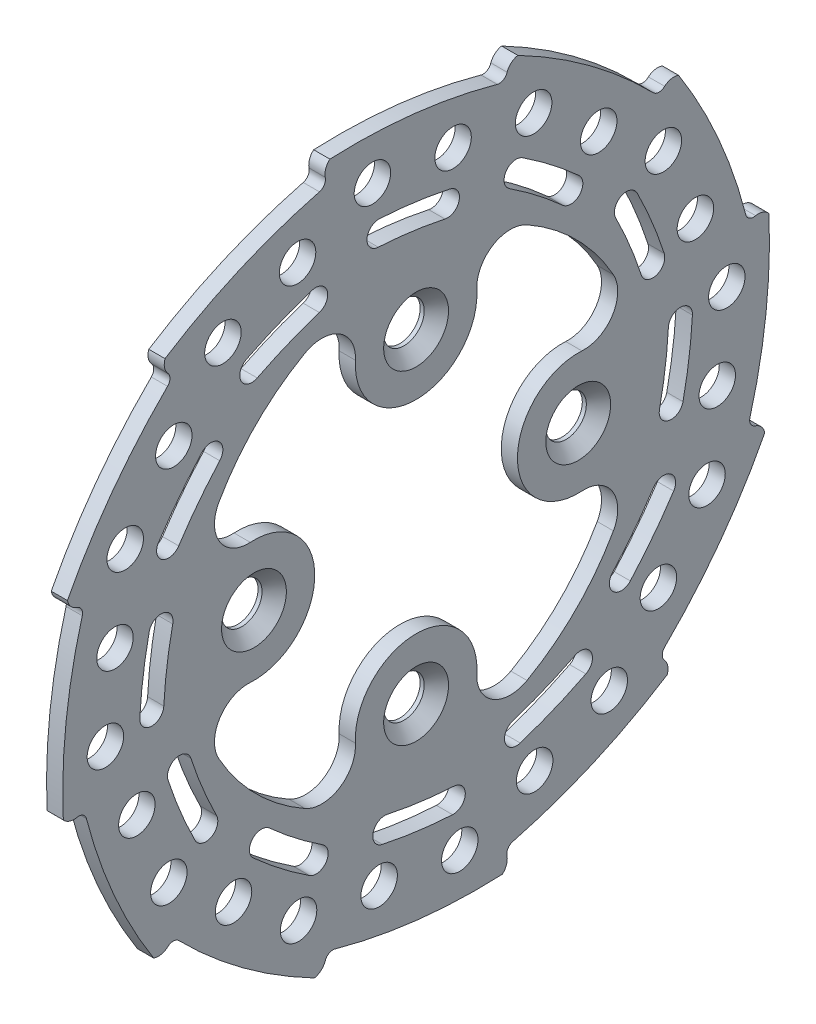
from build123d import *

# Parameters (mm, degrees)
SKETCH1_R           = 4.5
SKETCH1_R_2         = 5
BOSS_EXTRUDE1_DEPTH = 4
CHAMFER1_SIZE       = 3


with BuildPart() as part:
    # Sketch1 → Boss-Extrude1 (new body)
    with BuildSketch(Plane(origin=(4, 0, 0), x_dir=(0, 0, -1), z_dir=(1, 0, 0))):
        with BuildLine():
            ThreePointArc((-86.018670255, 25.093026142), (-85.14663657, 23.368422018), (-83.491153558, 22.37138735))
            Line((-83.491153558, 22.37138735), (-83.749739244, 22.440675176))
            ThreePointArc((-83.749739244, 22.440675176), (-82.550452091, 21.515925209), (-82.363415589, 20.013104685))
            ThreePointArc((-82.363415589, 20.013104685), (-86.341116655, -0.446853787), (-87.040866686, -21.278136905))
            ThreePointArc((-87.040866686, -21.278136905), (-85.423361304, -22.335671048), (-83.491153628, -22.371386896))
            Line((-83.491153628, -22.371386896), (-83.749739307, -22.44067472))
            ThreePointArc((-83.749739307, -22.44067472), (-82.248751182, -22.641888108), (-81.33536256, -23.849850608))
            ThreePointArc((-81.33536256, -23.849850608), (-74.550173469, -43.55754504), (-64.740533156, -61.947840518))
            ThreePointArc((-64.740533156, -61.947840518), (-62.810965331, -62.054939253), (-61.119766475, -61.119766243))
            Line((-61.119766475, -61.119766243), (-61.309064338, -61.309064106))
            ThreePointArc((-61.309064338, -61.309064106), (-59.908563797, -60.732825947), (-58.513564795, -61.322257846))
            ThreePointArc((-58.513564795, -61.322257846), (-42.78357145, -74.997027311), (-25.093025994, -86.018670202))
            ThreePointArc((-25.093025994, -86.018670202), (-23.368421895, -85.146636507), (-22.371387243, -83.491153507))
            Line((-22.371387243, -83.491153507), (-22.440675066, -83.749739182))
            ThreePointArc((-22.440675066, -83.749739182), (-21.515925099, -82.550452028), (-20.013104576, -82.363415525))
            ThreePointArc((-20.013104576, -82.363415525), (0.446853958, -86.341116583), (21.278137137, -87.040866585))
            ThreePointArc((21.278137137, -87.040866585), (22.335671395, -85.423361165), (22.371387267, -83.491153395))
            Line((22.371387267, -83.491153395), (22.440675097, -83.749739097))
            ThreePointArc((22.440675097, -83.749739097), (22.641888482, -82.248750972), (23.849850979, -81.335362346))
            ThreePointArc((23.849850979, -81.335362346), (43.55754532, -74.550173223), (61.947840706, -64.7405329))
            ThreePointArc((61.947840706, -64.7405329), (62.054939409, -62.810965107), (61.119766406, -61.119766286))
            Line((61.119766406, -61.119766286), (61.30906424, -61.309064119))
            ThreePointArc((61.30906424, -61.309064119), (60.732826081, -59.908563581), (61.322257978, -58.513564579))
            ThreePointArc((61.322257978, -58.513564579), (74.997027319, -42.783571336), (86.018670123, -25.093026012))
            ThreePointArc((86.018670123, -25.093026012), (85.146636466, -23.368421786), (83.4911534, -22.371387057))
            Line((83.4911534, -22.371387057), (83.749739198, -22.440674913))
            ThreePointArc((83.749739198, -22.440674913), (82.550452046, -21.515924947), (82.363415542, -20.013104426))
            ThreePointArc((82.363415542, -20.013104426), (86.341116572, 0.446854079), (87.040866557, 21.278137224))
            ThreePointArc((87.040866557, 21.278137224), (85.423361182, 22.335671327), (83.491153534, 22.371387165))
            Line((83.491153534, 22.371387165), (83.749739235, 22.440674994))
            ThreePointArc((83.749739235, 22.440674994), (82.248751112, 22.641888382), (81.335362488, 23.849850879))
            ThreePointArc((81.335362488, 23.849850879), (74.550173373, 43.557545259), (64.740533048, 61.947840683))
            ThreePointArc((64.740533048, 61.947840683), (62.810965153, 62.054939483), (61.119766223, 61.119766455))
            Line((61.119766223, 61.119766455), (61.309064147, 61.309064379))
            ThreePointArc((61.309064147, 61.309064379), (59.908563608, 60.73282622), (58.513564607, 61.322258116))
            ThreePointArc((58.513564607, 61.322258116), (42.783571403, 74.997027414), (25.093026131, 86.018670193))
            ThreePointArc((25.093026131, 86.018670193), (23.368421841, 85.14663655), (22.371387074, 83.491153446))
            Line((22.371387074, 83.491153446), (22.44067494, 83.749739283))
            ThreePointArc((22.44067494, 83.749739283), (21.515924975, 82.550452129), (20.013104453, 82.363415625))
            ThreePointArc((20.013104453, 82.363415625), (-0.446854092, 86.341116662), (-21.278137277, 87.040866642))
            ThreePointArc((-21.278137277, 87.040866642), (-22.335671323, 85.423361278), (-22.371387144, 83.491153671))
            Line((-22.371387144, 83.491153671), (-22.440674969, 83.749739354))
            ThreePointArc((-22.440674969, 83.749739354), (-22.641888355, 82.248751229), (-23.849850854, 81.335362604))
            ThreePointArc((-23.849850854, 81.335362604), (-43.557545227, 74.550173501), (-61.947840649, 64.740533195))
            ThreePointArc((-61.947840649, 64.740533195), (-62.054939394, 62.810965365), (-61.119766383, 61.119766503))
            Line((-61.119766383, 61.119766503), (-61.309064244, 61.309064364))
            ThreePointArc((-61.309064244, 61.309064364), (-60.732826085, 59.908563824), (-61.322257984, 58.513564821))
            ThreePointArc((-61.322257984, 58.513564821), (-74.997027395, 42.78357153), (-86.018670255, 25.093026142))
        make_face()
        with Locations((-45.046348597, -59.778523638)):
            Circle(SKETCH1_R, mode=Mode.SUBTRACT)
        with Locations((-60.999633167, -47.658136616)):
            Circle(SKETCH1_R, mode=Mode.SUBTRACT)
        with Locations((-28.998163636, -71.77297359)):
            Circle(SKETCH1_R, mode=Mode.SUBTRACT)
        with Locations((-9.122020413, -74.29289437)):
            Circle(SKETCH1_R, mode=Mode.SUBTRACT)
        with BuildLine():
            ThreePointArc((-26.291327741, -63.53719733), (-33.430015175, -58.462343647), (-40.153643305, -52.849160686))
            ThreePointArc((-40.153643305, -52.849160686), (-40.367322044, -48.659253445), (-36.177414803, -48.445574706))
            ThreePointArc((-36.177414803, -48.445574706), (-29.807264332, -53.76365884), (-23.043875245, -58.57171499))
            ThreePointArc((-23.043875245, -58.57171499), (-22.184860323, -62.678182407), (-26.291327741, -63.53719733))
        make_face(mode=Mode.SUBTRACT)
        with Locations((-68.900544051, -29.246545773)):
            Circle(SKETCH1_R, mode=Mode.SUBTRACT)
        with BuildLine():
            ThreePointArc((-49.24243886, -39.202655502), (-50.551743823, -43.188468066), (-54.537556387, -41.879163102))
            ThreePointArc((-54.537556387, -41.879163102), (-58.182414213, -33.914867175), (-61.198655499, -25.691894069))
            ThreePointArc((-61.198655499, -25.691894069), (-59.288753095, -21.956488591), (-55.553347617, -23.866390995))
            ThreePointArc((-55.553347617, -23.866390995), (-52.69567755, -31.65706219), (-49.24243886, -39.202655502))
        make_face(mode=Mode.SUBTRACT)
        with Locations((-76.656300252, -10.773340423)):
            Circle(SKETCH1_R, mode=Mode.SUBTRACT)
        with BuildLine():
            ThreePointArc((-68.170490843, -8.999640943), (-67.34488235, -0.279929433), (-65.845537375, 8.349494814))
            ThreePointArc((-65.845537375, 8.349494814), (-62.323810635, 10.62949965), (-60.043805798, 7.10777291))
            ThreePointArc((-60.043805798, 7.10777291), (-61.464326522, -1.067981291), (-62.246530747, -9.329276131))
            ThreePointArc((-62.246530747, -9.329276131), (-65.373328389, -12.126438585), (-68.170490843, -8.999640943))
        make_face(mode=Mode.SUBTRACT)
        with Locations((10.773340423, -76.656300252)):
            Circle(SKETCH1_R, mode=Mode.SUBTRACT)
        with Locations((29.246545773, -68.900544051)):
            Circle(SKETCH1_R, mode=Mode.SUBTRACT)
        with BuildLine():
            ThreePointArc((8.999640943, -68.170490842), (0.279929433, -67.344882349), (-8.349494814, -65.845537374))
            ThreePointArc((-8.349494814, -65.845537374), (-10.629499649, -62.323810635), (-7.10777291, -60.0438058))
            ThreePointArc((-7.10777291, -60.0438058), (1.067981291, -61.464326524), (9.329276131, -62.246530749))
            ThreePointArc((9.329276131, -62.246530749), (12.126438584, -65.37332839), (8.999640943, -68.170490842))
        make_face(mode=Mode.SUBTRACT)
        with BuildLine():
            ThreePointArc((41.879163103, -54.537556387), (33.914867175, -58.182414213), (25.69189407, -61.198655499))
            ThreePointArc((25.69189407, -61.198655499), (21.956488591, -59.288753096), (23.866390995, -55.553347617))
            ThreePointArc((23.866390995, -55.553347617), (31.65706219, -52.69567755), (39.202655503, -49.242438859))
            ThreePointArc((39.202655503, -49.242438859), (43.188468067, -50.551743823), (41.879163103, -54.537556387))
        make_face(mode=Mode.SUBTRACT)
        with Locations((47.658136616, -60.999633167)):
            Circle(SKETCH1_R, mode=Mode.SUBTRACT)
        with Locations((59.778523638, -45.046348596)):
            Circle(SKETCH1_R, mode=Mode.SUBTRACT)
        with BuildLine():
            ThreePointArc((48.674377168, 27.370060379), (48.473017416, 18.865297032), (40.908809804, 14.972443512))
            ThreePointArc((40.908809804, 14.972443511), (25.000000001, -1e-09), (40.908809804, -14.972443513))
            ThreePointArc((40.908809804, -14.972443513), (48.473017416, -18.865297033), (48.674377168, -27.37006038))
            ThreePointArc((48.674377168, -27.37006038), (39.486169717, -39.486169718), (27.37006038, -48.674377168))
            ThreePointArc((27.37006038, -48.674377168), (18.865297033, -48.473017417), (14.972443512, -40.908809805))
            ThreePointArc((14.972443513, -40.908809805), (0, -25), (-14.972443513, -40.908809805))
            ThreePointArc((-14.972443512, -40.908809805), (-18.865297033, -48.473017417), (-27.370060379, -48.674377168))
            ThreePointArc((-27.370060379, -48.674377168), (-39.486169717, -39.486169718), (-48.674377168, -27.37006038))
            ThreePointArc((-48.674377168, -27.37006038), (-48.473017416, -18.865297033), (-40.908809804, -14.972443513))
            ThreePointArc((-40.908809804, -14.972443513), (-24.999999999, 0), (-40.908809804, 14.972443513))
            ThreePointArc((-40.908809804, 14.972443512), (-48.473017416, 18.865297032), (-48.674377168, 27.370060379))
            ThreePointArc((-48.674377168, 27.370060379), (-39.486169717, 39.486169717), (-27.370060379, 48.674377168))
            ThreePointArc((-27.370060379, 48.674377168), (-18.865297033, 48.473017416), (-14.972443512, 40.908809804))
            ThreePointArc((-14.972443512, 40.908809804), (1e-09, 25), (14.972443513, 40.908809804))
            ThreePointArc((14.972443512, 40.908809804), (18.865297033, 48.473017416), (27.37006038, 48.674377168))
            ThreePointArc((27.37006038, 48.674377168), (39.486169717, 39.486169717), (48.674377168, 27.370060379))
        make_face(mode=Mode.SUBTRACT)
        with BuildLine():
            ThreePointArc((63.53719733, -26.291327741), (58.462343647, -33.430015175), (52.849160686, -40.153643305))
            ThreePointArc((52.849160686, -40.153643305), (48.659253445, -40.367322044), (48.445574706, -36.177414803))
            ThreePointArc((48.445574706, -36.177414803), (53.76365884, -29.807264332), (58.57171499, -23.043875245))
            ThreePointArc((58.57171499, -23.043875245), (62.678182408, -22.184860323), (63.53719733, -26.291327741))
        make_face(mode=Mode.SUBTRACT)
        with Locations((71.77297359, -28.998163636)):
            Circle(SKETCH1_R, mode=Mode.SUBTRACT)
        with Locations((74.29289437, -9.122020413)):
            Circle(SKETCH1_R, mode=Mode.SUBTRACT)
        with Locations((-74.29289437, 9.122020413)):
            Circle(SKETCH1_R, mode=Mode.SUBTRACT)
        with Locations((-71.77297359, 28.998163636)):
            Circle(SKETCH1_R, mode=Mode.SUBTRACT)
        with BuildLine():
            ThreePointArc((-63.53719733, 26.29132774), (-58.462343647, 33.430015175), (-52.849160686, 40.153643305))
            ThreePointArc((-52.849160686, 40.153643305), (-48.659253446, 40.367322044), (-48.445574707, 36.177414804))
            ThreePointArc((-48.445574707, 36.177414804), (-53.763658841, 29.807264332), (-58.57171499, 23.043875246))
            ThreePointArc((-58.57171499, 23.043875246), (-62.678182407, 22.184860323), (-63.53719733, 26.29132774))
        make_face(mode=Mode.SUBTRACT)
        with Locations((-59.778523638, 45.046348597)):
            Circle(SKETCH1_R, mode=Mode.SUBTRACT)
        with Locations((-47.658136616, 60.999633167)):
            Circle(SKETCH1_R, mode=Mode.SUBTRACT)
        with BuildLine():
            ThreePointArc((-41.879163102, 54.537556387), (-33.914867175, 58.182414213), (-25.691894069, 61.198655499))
            ThreePointArc((-25.691894069, 61.198655499), (-21.95648859, 59.288753095), (-23.866390994, 55.553347616))
            ThreePointArc((-23.866390994, 55.553347616), (-31.65706219, 52.695677549), (-39.202655502, 49.242438859))
            ThreePointArc((-39.202655502, 49.242438859), (-43.188468066, 50.551743823), (-41.879163102, 54.537556387))
        make_face(mode=Mode.SUBTRACT)
        with BuildLine():
            ThreePointArc((-8.999640943, 68.170490843), (-0.279929433, 67.34488235), (8.349494814, 65.845537375))
            ThreePointArc((8.349494814, 65.845537375), (10.62949965, 62.323810635), (7.10777291, 60.043805798))
            ThreePointArc((7.10777291, 60.043805798), (-1.067981291, 61.464326522), (-9.329276131, 62.246530747))
            ThreePointArc((-9.329276131, 62.246530747), (-12.126438585, 65.37332839), (-8.999640943, 68.170490843))
        make_face(mode=Mode.SUBTRACT)
        with Locations((-29.246545773, 68.900544051)):
            Circle(SKETCH1_R, mode=Mode.SUBTRACT)
        with Locations((-10.773340423, 76.656300252)):
            Circle(SKETCH1_R, mode=Mode.SUBTRACT)
        with BuildLine():
            ThreePointArc((68.170490843, 8.999640943), (67.34488235, 0.279929433), (65.845537375, -8.349494814))
            ThreePointArc((65.845537375, -8.349494814), (62.323810635, -10.62949965), (60.043805798, -7.10777291))
            ThreePointArc((60.043805798, -7.10777291), (61.464326522, 1.067981291), (62.246530747, 9.329276131))
            ThreePointArc((62.246530747, 9.329276131), (65.373328389, 12.126438585), (68.170490843, 8.999640943))
        make_face(mode=Mode.SUBTRACT)
        with Locations((76.656300252, 10.773340423)):
            Circle(SKETCH1_R, mode=Mode.SUBTRACT)
        with BuildLine():
            ThreePointArc((54.537556388, 41.879163102), (58.182414214, 33.914867175), (61.1986555, 25.69189407))
            ThreePointArc((61.1986555, 25.69189407), (59.288753096, 21.95648859), (55.553347616, 23.866390994))
            ThreePointArc((55.553347616, 23.866390994), (52.695677549, 31.65706219), (49.242438859, 39.202655502))
            ThreePointArc((49.242438859, 39.202655502), (50.551743823, 43.188468066), (54.537556388, 41.879163102))
        make_face(mode=Mode.SUBTRACT)
        with Locations((68.900544051, 29.246545773)):
            Circle(SKETCH1_R, mode=Mode.SUBTRACT)
        with BuildLine():
            ThreePointArc((26.291327741, 63.53719733), (33.430015175, 58.462343647), (40.153643305, 52.849160686))
            ThreePointArc((40.153643305, 52.849160686), (40.367322044, 48.659253446), (36.177414803, 48.445574707))
            ThreePointArc((36.177414803, 48.445574707), (29.807264332, 53.76365884), (23.043875245, 58.57171499))
            ThreePointArc((23.043875245, 58.57171499), (22.184860323, 62.678182408), (26.291327741, 63.53719733))
        make_face(mode=Mode.SUBTRACT)
        with Locations((9.122020413, 74.29289437)):
            Circle(SKETCH1_R, mode=Mode.SUBTRACT)
        with Locations((28.998163636, 71.77297359)):
            Circle(SKETCH1_R, mode=Mode.SUBTRACT)
        with Locations((60.999633167, 47.658136616)):
            Circle(SKETCH1_R, mode=Mode.SUBTRACT)
        with Locations((45.046348596, 59.778523638)):
            Circle(SKETCH1_R, mode=Mode.SUBTRACT)
        with Locations((40, 0)):
            Circle(SKETCH1_R_2, mode=Mode.SUBTRACT)
        with Locations((0, 40)):
            Circle(SKETCH1_R_2, mode=Mode.SUBTRACT)
        with Locations((0, -40)):
            Circle(SKETCH1_R_2, mode=Mode.SUBTRACT)
        with Locations((-40, 0)):
            Circle(SKETCH1_R_2, mode=Mode.SUBTRACT)
    extrude(amount=BOSS_EXTRUDE1_DEPTH)

    # Chamfer1
    chamfer1_edges = [part.edges().sort_by_distance(p)[0] for p in [
        (8, 0, 45),
        (8, -40, 5),
        (8, 0, -35),
        (8, 40, 5),
    ]]
    chamfer(chamfer1_edges, length=CHAMFER1_SIZE)


solid = part.part
